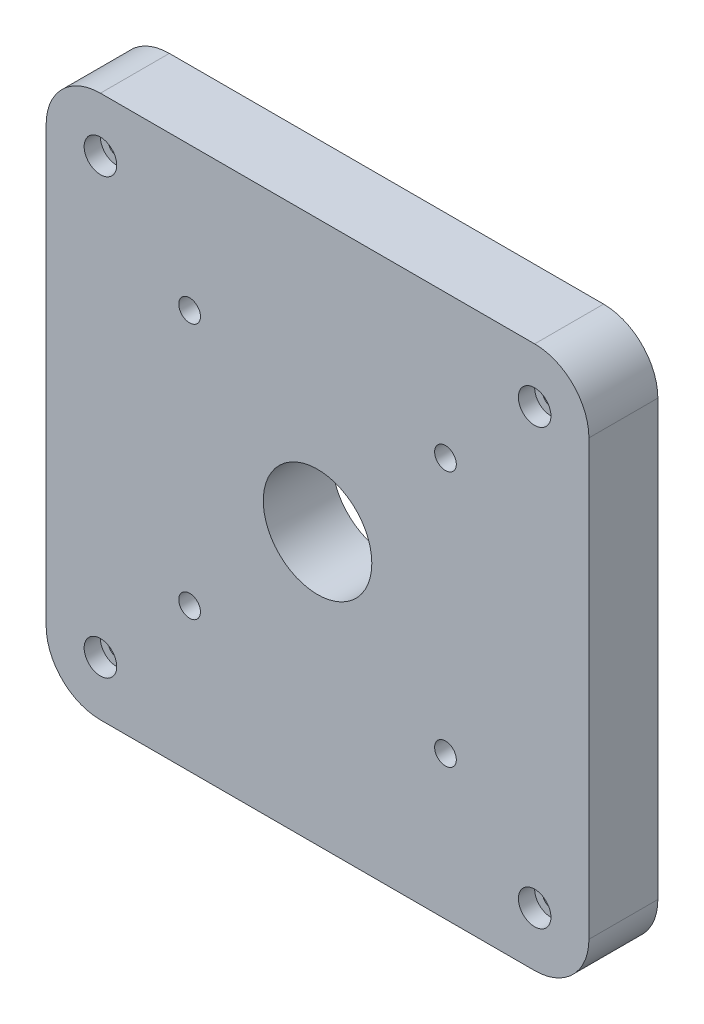
from build123d import *

# Parameters (mm, degrees)
SALIENTE_EXTRUIR1_DEPTH = 12.7
CROQUIS2_R              = 3
CORTAR_EXTRUIR1_DEPTH   = 3
CROQUIS3_R              = 10
CROQUIS3_R_2            = 2
CORTAR_EXTRUIR2_DEPTH   = 31
CROQUIS4_R              = 1.5
CORTAR_EXTRUIR3_DEPTH   = 31
CROQUIS5_R              = 4
CORTAR_EXTRUIR4_DEPTH   = 3


with BuildPart() as part:
    # Croquis1 → Saliente-Extruir1 (new body)
    with BuildSketch(Plane.XY):
        with BuildLine():
            Line((10, 0), (90, 0))
            ThreePointArc((90, 0), (97.071067812, 2.928932188), (100, 10))
            Line((100, 10), (100, 90))
            ThreePointArc((100, 90), (97.071067812, 97.071067812), (90, 100))
            Line((90, 100), (10, 100))
            ThreePointArc((10, 100), (2.928932188, 97.071067812), (0, 90))
            Line((0, 90), (0, 10))
            ThreePointArc((0, 10), (2.928932188, 2.928932188), (10, 0))
        make_face()
    extrude(amount=SALIENTE_EXTRUIR1_DEPTH)

    # Croquis2 → Cortar-Extruir1 (cut)
    with BuildSketch(Plane.XY.offset(12.7)):
        with Locations((10, 90)):
            Circle(CROQUIS2_R)
        with Locations((10, 10)):
            Circle(CROQUIS2_R)
        with Locations((90, 90)):
            Circle(CROQUIS2_R)
        with Locations((90, 10)):
            Circle(CROQUIS2_R)
    extrude(amount=-CORTAR_EXTRUIR1_DEPTH, mode=Mode.SUBTRACT)

    # Croquis3 → Cortar-Extruir2 (cut)
    with BuildSketch(Plane.XY.offset(12.7)):
        with Locations((50, 50)):
            Circle(CROQUIS3_R)
        with Locations((26.43, 73.57)):
            Circle(CROQUIS3_R_2)
        with Locations((73.57, 73.57)):
            Circle(CROQUIS3_R_2)
        with Locations((26.43, 26.43)):
            Circle(CROQUIS3_R_2)
        with Locations((73.57, 26.43)):
            Circle(CROQUIS3_R_2)
    extrude(amount=-CORTAR_EXTRUIR2_DEPTH, mode=Mode.SUBTRACT)

    # Croquis4 → Cortar-Extruir3 (cut)
    with BuildSketch(Plane.XY.offset(9.7)):
        with Locations((10, 90)):
            Circle(CROQUIS4_R)
        with Locations((90, 90)):
            Circle(CROQUIS4_R)
        with Locations((90, 10)):
            Circle(CROQUIS4_R)
        with Locations((10, 10)):
            Circle(CROQUIS4_R)
    extrude(amount=-CORTAR_EXTRUIR3_DEPTH, mode=Mode.SUBTRACT)

    # Croquis5 → Cortar-Extruir4 (cut)
    with BuildSketch(Plane(origin=(0, 0, 0), x_dir=(-1, 0, 0), z_dir=(0, 0, -1))):
        with Locations((-73.57, 73.57)):
            Circle(CROQUIS5_R)
        with Locations((-26.43, 73.57)):
            Circle(CROQUIS5_R)
        with Locations((-26.43, 26.43)):
            Circle(CROQUIS5_R)
        with Locations((-73.57, 26.43)):
            Circle(CROQUIS5_R)
    extrude(amount=-CORTAR_EXTRUIR4_DEPTH, mode=Mode.SUBTRACT)


solid = part.part
